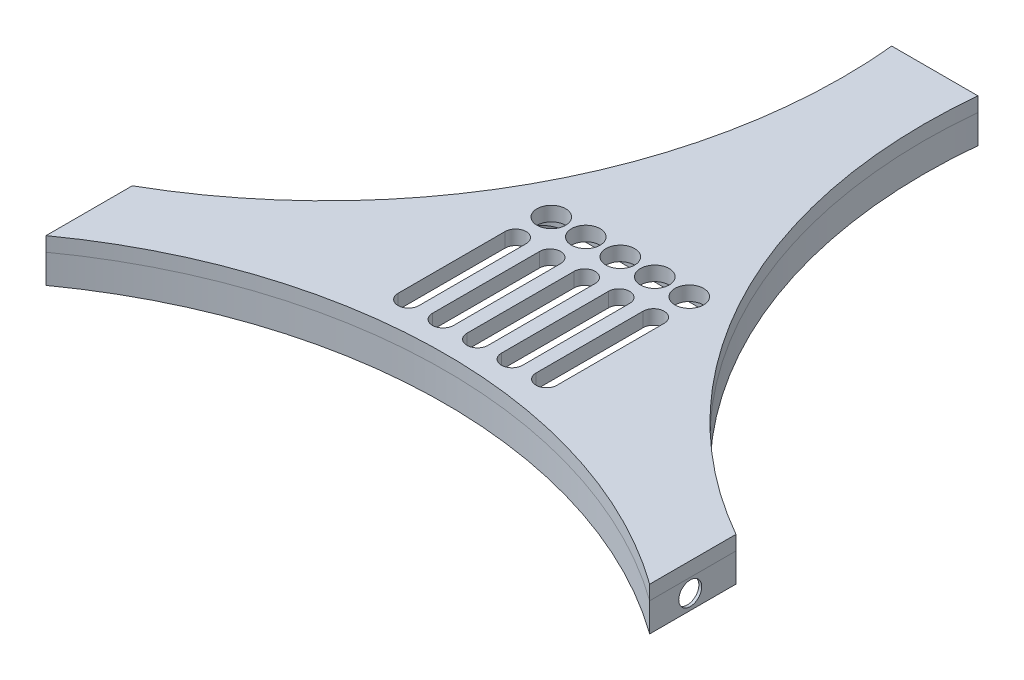
from build123d import *

# Parameters (mm, degrees)
BOSS_EXTRUDE1_DEPTH = 0.5
EXTRUDE_THIN2_DEPTH = 0.5
SKETCH4_R           = 0.499321112
CUT_EXTRUDE1_DEPTH  = 0.5
EXTRUDE_THIN3_DEPTH = 1
SKETCH12_R          = 0.4
CUT_EXTRUDE2_DEPTH  = 0.5
SKETCH13_R          = 0.4
CUT_EXTRUDE3_DEPTH  = 0.5
SKETCH14_R          = 0.4
CUT_EXTRUDE4_DEPTH  = 1


with BuildPart() as part:
    # Sketch1 → Boss-Extrude1 (new body)
    with BuildSketch(Plane(origin=(0, 0, 0), x_dir=(1, 0, 0), z_dir=(0, 1, 0))):
        with BuildLine():
            Line((10.5, 0.58), (10.5, -2.42))
            ThreePointArc((10.5, -2.42), (0, 0.959808483), (-10.5, -2.42))
            Line((-10.5, -2.42), (-10.5, 0.58))
            ThreePointArc((-10.5, 0.58), (-3.419893457, 7.956994323), (-1.5, 18))
            Line((-1.5, 18), (1.5, 18))
            ThreePointArc((1.5, 18), (3.419893457, 7.956994323), (10.5, 0.58))
        make_face()
    extrude(amount=BOSS_EXTRUDE1_DEPTH)

    # Sketch2 → Extrude-Thin2 (add)
    with BuildSketch(Plane.XZ):
        with BuildLine():
            Line((3.619286336, -2.06724443), (3.619286336, -6.76738737))
            ThreePointArc((3.619286336, -6.76738737), (3.297103795, -7.545204829), (2.519286336, -7.86738737))
            Line((2.519286336, -7.86738737), (-2.519286336, -7.86738737))
            ThreePointArc((-2.519286336, -7.86738737), (-3.297103795, -7.545204829), (-3.619286336, -6.76738737))
            Line((-3.619286336, -6.76738737), (-3.619286336, -2.06724443))
            ThreePointArc((-3.619286336, -2.06724443), (-3.297103795, -1.289426971), (-2.519286336, -0.96724443))
            Line((-2.519286336, -0.96724443), (2.519286336, -0.96724443))
            ThreePointArc((2.519286336, -0.96724443), (3.297103795, -1.289426971), (3.619286336, -2.06724443))
        make_face()
        with BuildLine():
            Line((3.519286336, -2.06724443), (3.519286336, -6.76738737))
            ThreePointArc((3.519286336, -6.76738737), (3.226393117, -7.474494151), (2.519286336, -7.76738737))
            Line((2.519286336, -7.76738737), (-2.519286336, -7.76738737))
            ThreePointArc((-2.519286336, -7.76738737), (-3.226393117, -7.474494151), (-3.519286336, -6.76738737))
            Line((-3.519286336, -6.76738737), (-3.519286336, -2.06724443))
            ThreePointArc((-3.519286336, -2.06724443), (-3.226393117, -1.360137649), (-2.519286336, -1.06724443))
            Line((-2.519286336, -1.06724443), (2.519286336, -1.06724443))
            ThreePointArc((2.519286336, -1.06724443), (3.226393117, -1.360137649), (3.519286336, -2.06724443))
        make_face(mode=Mode.SUBTRACT)
    extrude(amount=EXTRUDE_THIN2_DEPTH)

    # Sketch4 → Cut-Extrude1 (cut)
    with BuildSketch(Plane.XZ):
        with Locations(Location((-2.271975482, -6.929189414, 0), (0, 0, 270))):
            Circle(SKETCH4_R)
        with Locations(Location((-1.071975482, -6.929189414, 0), (0, 0, 270))):
            Circle(SKETCH4_R)
        with Locations(Location((0.128024518, -6.929189414, 0), (0, 0, 270))):
            Circle(SKETCH4_R)
        with Locations(Location((1.328024518, -6.929189414, 0), (0, 0, 270))):
            Circle(SKETCH4_R)
        with Locations(Location((2.528024518, -6.929189414, 0), (0, 0, 270))):
            Circle(SKETCH4_R)
        with BuildLine():
            Line((-1.905072609, -1.961888982), (-1.905072609, -5.687364306))
            ThreePointArc((-1.905072609, -5.687364306), (-2.271975482, -6.054267179), (-2.638878355, -5.687364306))
            Line((-2.638878355, -5.687364306), (-2.638878355, -1.961888982))
            ThreePointArc((-2.638878355, -1.961888982), (-2.271975482, -1.594986109), (-1.905072609, -1.961888982))
        make_face()
        with BuildLine():
            Line((-0.705072609, -1.961888982), (-0.705072609, -5.687364306))
            ThreePointArc((-0.705072609, -5.687364306), (-1.071975482, -6.054267179), (-1.438878355, -5.687364306))
            Line((-1.438878355, -5.687364306), (-1.438878355, -1.961888982))
            ThreePointArc((-1.438878355, -1.961888982), (-1.071975482, -1.594986109), (-0.705072609, -1.961888982))
        make_face()
        with BuildLine():
            Line((0.494927391, -1.961888982), (0.494927391, -5.687364306))
            ThreePointArc((0.494927391, -5.687364306), (0.128024518, -6.054267179), (-0.238878355, -5.687364306))
            Line((-0.238878355, -5.687364306), (-0.238878355, -1.961888982))
            ThreePointArc((-0.238878355, -1.961888982), (0.128024518, -1.594986109), (0.494927391, -1.961888982))
        make_face()
        with BuildLine():
            Line((1.694927391, -1.961888982), (1.694927391, -5.687364306))
            ThreePointArc((1.694927391, -5.687364306), (1.328024518, -6.054267179), (0.961121645, -5.687364306))
            Line((0.961121645, -5.687364306), (0.961121645, -1.961888982))
            ThreePointArc((0.961121645, -1.961888982), (1.328024518, -1.594986109), (1.694927391, -1.961888982))
        make_face()
        with BuildLine():
            Line((2.894927391, -1.961888982), (2.894927391, -5.687364306))
            ThreePointArc((2.894927391, -5.687364306), (2.528024518, -6.054267179), (2.161121645, -5.687364306))
            Line((2.161121645, -5.687364306), (2.161121645, -1.961888982))
            ThreePointArc((2.161121645, -1.961888982), (2.528024518, -1.594986109), (2.894927391, -1.961888982))
        make_face()
    extrude(amount=-CUT_EXTRUDE1_DEPTH, mode=Mode.SUBTRACT)


with BuildPart() as body_2:
    # Sketch6 → Extrude-Thin3 (new body)
    with BuildSketch(Plane.XZ):
        with BuildLine():
            Line((-10.5, -0.58), (-10.5, 2.42))
            ThreePointArc((-10.5, 2.42), (0, -0.959808483), (10.5, 2.42))
            Line((10.5, 2.42), (10.5, -0.58))
            ThreePointArc((10.5, -0.58), (3.419893457, -7.956994323), (1.5, -18))
            Line((1.5, -18), (-1.5, -18))
            ThreePointArc((-1.5, -18), (-3.419893457, -7.956994323), (-10.5, -0.58))
        make_face()
        with BuildLine():
            Line((-10.4, -0.521994843), (-10.4, 2.226346642))
            ThreePointArc((-10.4, 2.226346642), (0, -1.059808483), (10.4, 2.226346642))
            Line((10.4, 2.226346642), (10.4, -0.521994843))
            ThreePointArc((10.4, -0.521994843), (3.343055425, -7.887897883), (1.389902711, -17.9))
            Line((1.389902711, -17.9), (-1.389902711, -17.9))
            ThreePointArc((-1.389902711, -17.9), (-3.343055425, -7.887897883), (-10.4, -0.521994843))
        make_face(mode=Mode.SUBTRACT)
    extrude(amount=EXTRUDE_THIN3_DEPTH)

    # Sketch12 → Cut-Extrude2 (cut, symmetric)
    with BuildSketch(Plane.ZY.offset(10.5)):
        with Locations(Location((0.925556485, -0.534903511, 0), (0, 0, 180))):
            Circle(SKETCH12_R)
    extrude(amount=CUT_EXTRUDE2_DEPTH, both=True, mode=Mode.SUBTRACT)

    # Sketch13 → Cut-Extrude3 (cut, symmetric)
    with BuildSketch(Plane(origin=(10.5, 0, 0), x_dir=(0, 0, -1), z_dir=(1, 0, 0))):
        with Locations(Location((-1.009896001, -0.478993576, 0), (0, 0, 180))):
            Circle(SKETCH13_R)
    extrude(amount=CUT_EXTRUDE3_DEPTH, both=True, mode=Mode.SUBTRACT)

    # Sketch14 → Cut-Extrude4 (cut)
    with BuildSketch(Plane(origin=(0, 0, -18), x_dir=(-1, 0, 0), z_dir=(0, 0, -1))):
        with Locations((0, -0.425681427)):
            Circle(SKETCH14_R)
    extrude(amount=-CUT_EXTRUDE4_DEPTH, mode=Mode.SUBTRACT)


solid = Compound([part.part, body_2.part])
